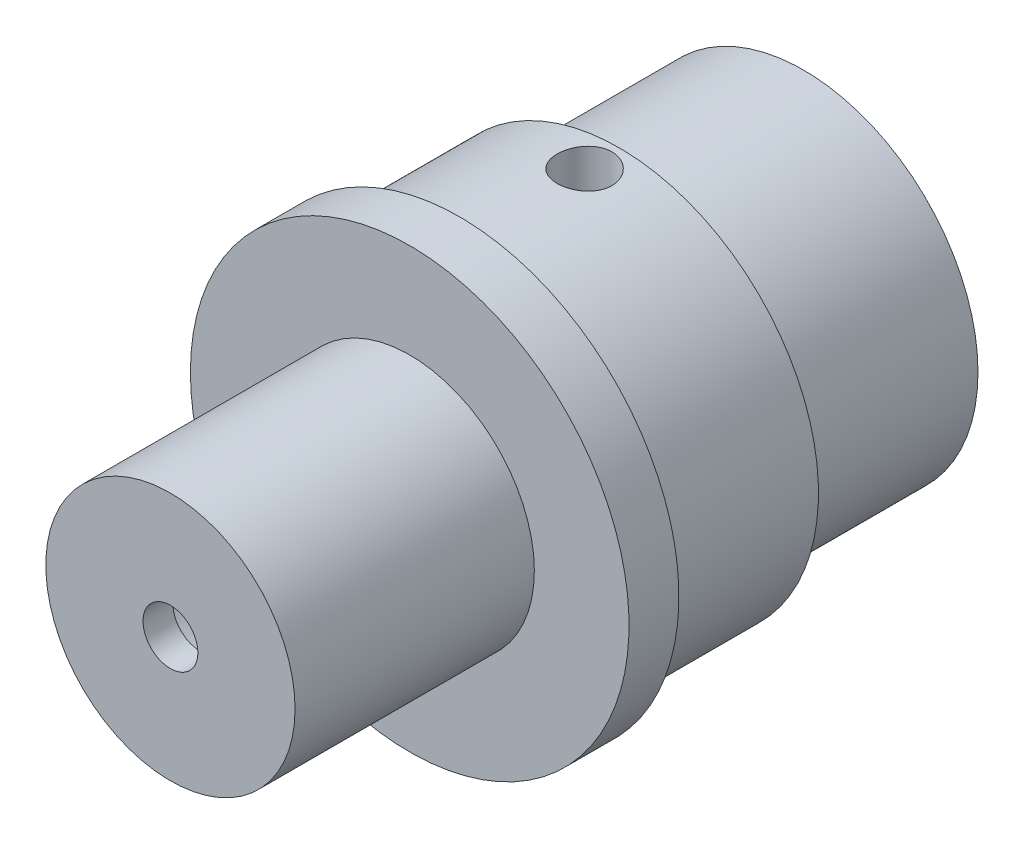
from build123d import *

# Parameters (mm, degrees)
SKETCH2_R               = 3.175
BOSS_EXTRUDE1_DEPTH     = 6.096
SKETCH3_R               = 5.588
BOSS_EXTRUDE2_DEPTH     = 1.27
SKETCH4_R               = 5.08
BOSS_EXTRUDE3_DEPTH     = 4.064
SKETCH5_R               = 4.445
BOSS_EXTRUDE4_DEPTH     = 4.699
SKETCH6_R               = 3.3655
CUT_EXTRUDE1_DEPTH      = 7.112
SKETCH7_R               = 2.2225
CUT_EXTRUDE2_DEPTH      = 8.255
SKETCH8_R               = 0.6985
CUT_EXTRUDE3_DEPTH      = 18.960961249
CUT_EXTRUDE4_DEPTH      = 8.255
CUT_EXTRUDE4_DEPTH_BACK = 8.255
SKETCH9_R               = 0.6985


with BuildPart() as part:
    # Sketch2 → Boss-Extrude1 (new body)
    with BuildSketch(Plane.XY):
        Circle(SKETCH2_R)
    extrude(amount=-BOSS_EXTRUDE1_DEPTH)

    # Sketch3 → Boss-Extrude2 (add)
    with BuildSketch(Plane(origin=(0, 0, -6.096), x_dir=(-1, 0, 0), z_dir=(0, 0, -1))):
        Circle(SKETCH3_R)
    extrude(amount=BOSS_EXTRUDE2_DEPTH)

    # Sketch4 → Boss-Extrude3 (add)
    with BuildSketch(Plane(origin=(0, 0, -7.366), x_dir=(-1, 0, 0), z_dir=(0, 0, -1))):
        Circle(SKETCH4_R)
    extrude(amount=BOSS_EXTRUDE3_DEPTH)

    # Sketch5 → Boss-Extrude4 (add)
    with BuildSketch(Plane(origin=(0, 0, -11.43), x_dir=(-1, 0, 0), z_dir=(0, 0, -1))):
        Circle(SKETCH5_R)
    extrude(amount=BOSS_EXTRUDE4_DEPTH)

    # Sketch6 → Cut-Extrude1 (cut)
    with BuildSketch(Plane(origin=(0, 0, -16.129), x_dir=(-1, 0, 0), z_dir=(0, 0, -1))):
        Circle(SKETCH6_R)
    extrude(amount=-CUT_EXTRUDE1_DEPTH, mode=Mode.SUBTRACT)

    # Sketch7 → Cut-Extrude2 (cut)
    with BuildSketch(Plane(origin=(0, 0, -9.017), x_dir=(-1, 0, 0), z_dir=(0, 0, -1))):
        Circle(SKETCH7_R)
    extrude(amount=-CUT_EXTRUDE2_DEPTH, mode=Mode.SUBTRACT)

    # Sketch8 → Cut-Extrude3 (cut, through all)
    with BuildSketch(Plane.XY):
        Circle(SKETCH8_R)
    extrude(amount=-CUT_EXTRUDE3_DEPTH, mode=Mode.SUBTRACT)

    # Sketch9 → Cut-Extrude4 (cut, two sides: drawn at the far end of the back side and taken through both)
    with BuildSketch(Plane(origin=(0, 0, 0), x_dir=(1, 0, 0), z_dir=(0, 1, 0)).offset(-CUT_EXTRUDE4_DEPTH_BACK)):
        with Locations((0, 10.549993494)):
            Circle(SKETCH9_R)
    extrude(amount=CUT_EXTRUDE4_DEPTH + CUT_EXTRUDE4_DEPTH_BACK, mode=Mode.SUBTRACT)


solid = part.part
